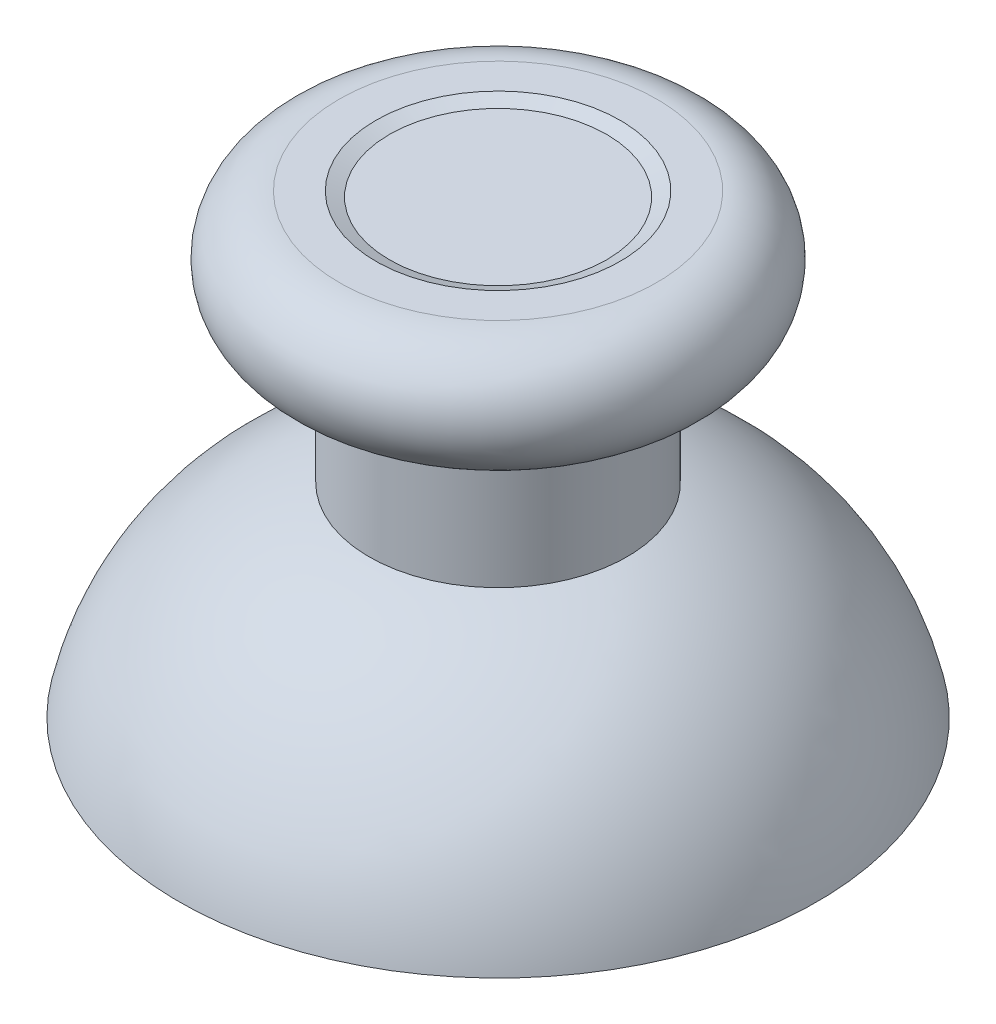
from build123d import *

# Parameters (mm, degrees)
SKETCH2_R           = 2.5
BOSS_EXTRUDE2_DEPTH = 4
CUT_EXTRUDE1_DEPTH  = 20.550319811


with BuildPart() as part:
    # Sketch1 → Revolve1 (revolve)
    with BuildSketch(Plane.XY):
        with BuildLine():
            ThreePointArc((2, 6.5), (7.211992141, 4.675975116), (10.149199243, 0))
            Line((10.149199243, 0), (11.75, 0))
            ThreePointArc((11.75, 0), (9.285070189, 4.71606551), (4.75, 7.5))
            Line((4.75, 7.5), (4.75, 12.5))
            Line((4.75, 12.5), (5.85, 12.5))
            ThreePointArc((5.85, 12.5), (8, 14.65), (5.85, 16.8))
            Line((5.85, 16.8), (4.5, 16.8))
            Line((4.5, 16.8), (4, 16.6))
            Line((4, 16.6), (0, 16.6))
            Line((0, 16.6), (0, 6.5))
            Line((0, 6.5), (2, 6.5))
        make_face()
    revolve(axis=Axis((0, 0, 0), (0, -1, 0)))

    # Sketch2 → Boss-Extrude2 (add)
    with BuildSketch(Plane.XZ.offset(-6.5)):
        Circle(SKETCH2_R)
    extrude(amount=BOSS_EXTRUDE2_DEPTH)

    # Sketch2<3> → Cut-Extrude1 (cut, through all)
    with BuildSketch(Plane.XZ.offset(-6.5)):
        with BuildLine():
            Line((1.5, -0.5), (1.5, 0.5))
            ThreePointArc((1.5, 0.5), (0, 2), (-1.5, 0.5))
            Line((-1.5, 0.5), (-1.5, -0.5))
            ThreePointArc((-1.5, -0.5), (0, -2), (1.5, -0.5))
        make_face()
    extrude(amount=CUT_EXTRUDE1_DEPTH, mode=Mode.SUBTRACT)


solid = part.part
